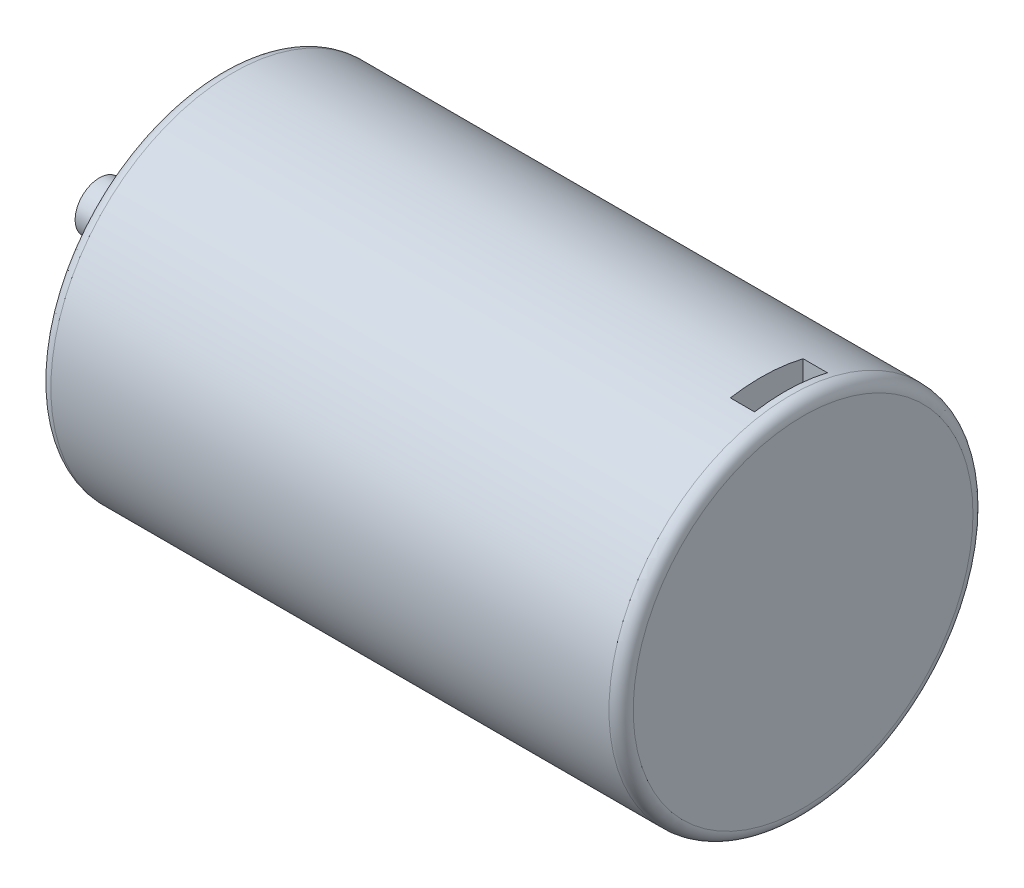
from build123d import *

# Parameters (mm, degrees)
SKETCH_1_R          = 15
EXTRUDE_1_DEPTH     = 48
SKETCH_2_R          = 2
EXTRUDE_2_DEPTH     = 10
SKETCH_3_R          = 3
EXTRUDE_3_DEPTH     = 3
FILLET_1_R          = 1
FILLET_2_R          = 1
CUT_EXTRUDE_START   = 15
SKETCH_4_W          = 2
SKETCH_4_H          = 6
CUT_EXTRUDE_1_DEPTH = 3


with BuildPart() as part:
    # 草图1 → 凸台-拉伸1 (new body)
    with BuildSketch(Plane(origin=(0, 0, 0), x_dir=(0, 0, -1), z_dir=(1, 0, 0))):
        Circle(SKETCH_1_R)
    extrude(amount=-EXTRUDE_1_DEPTH)

    # 草图2 → 凸台-拉伸2 (add)
    with BuildSketch(Plane.ZY.offset(48)):
        with Locations(Location((0, 0, 0), (0, 0, 180))):
            Circle(SKETCH_2_R)
    extrude(amount=EXTRUDE_2_DEPTH)

    # 草图3 → 凸台-拉伸3 (add)
    with BuildSketch(Plane.ZY.offset(48)):
        with Locations(Location((0, 0, 0), (0, 0, 180))):
            Circle(SKETCH_3_R)
    extrude(amount=EXTRUDE_3_DEPTH)

    # 圆角1
    fillet_1_edges = [part.edges().sort_by_distance(p)[0] for p in [
        (-48, 0, 15),
    ]]
    fillet(fillet_1_edges, radius=FILLET_1_R)

    # 圆角2
    fillet_2_edges = [part.edges().sort_by_distance(p)[0] for p in [
        (0, 0, 15),
    ]]
    fillet(fillet_2_edges, radius=FILLET_2_R)

    # 草图4 → 切除-拉伸1 (cut)
    with BuildSketch(Plane(origin=(0, 0, 0), x_dir=(1, 0, 0), z_dir=(0, 1, 0)).offset(CUT_EXTRUDE_START)):
        with Locations((-2.5, 0.5)):
            Rectangle(SKETCH_4_W, SKETCH_4_H)
    extrude(amount=-CUT_EXTRUDE_1_DEPTH, mode=Mode.SUBTRACT)


solid = part.part
